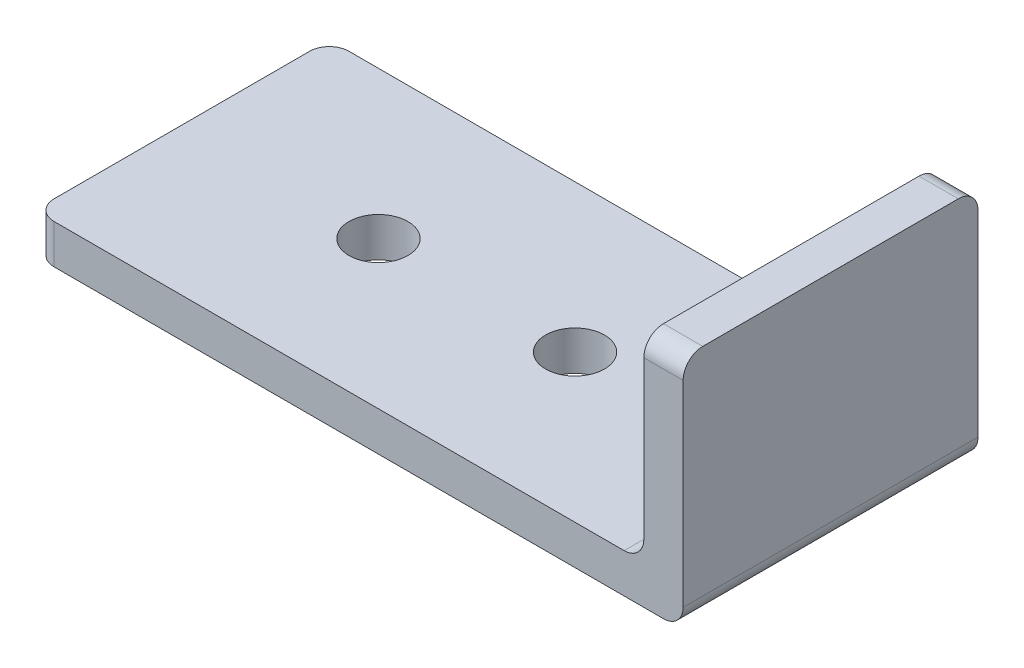
from build123d import *

# Parameters (mm, degrees)
BOSS_EXTRUDE1_DEPTH = 2
SKETCH2_W           = 2
SKETCH2_H           = 15
BOSS_EXTRUDE2_DEPTH = 10
FILLET1_R           = 1
FILLET2_R           = 1


with BuildPart() as part:
    # Sketch1 → Boss-Extrude1 (new body)
    with BuildSketch(Plane(origin=(0, 0, 0), x_dir=(1, 0, 0), z_dir=(0, 1, 0))):
        with BuildLine():
            Line((33, 7.5), (21.5, 7.5))
            ThreePointArc((21.5, 7.5), (20, 6), (18.5, 7.5))
            Line((18.5, 7.5), (11.5, 7.5))
            ThreePointArc((11.5, 7.5), (10, 6), (8.5, 7.5))
            Line((8.5, 7.5), (0, 7.5))
            Line((0, 7.5), (0, 0))
            Line((0, 0), (33, 0))
            Line((33, 0), (33, 7.5))
        make_face()
        with BuildLine():
            ThreePointArc((18.5, 7.5), (20, 9), (21.5, 7.5))
            Line((21.5, 7.5), (33, 7.5))
            Line((33, 7.5), (33, 15))
            Line((33, 15), (0, 15))
            Line((0, 15), (0, 7.5))
            Line((0, 7.5), (8.5, 7.5))
            ThreePointArc((8.5, 7.5), (10, 9), (11.5, 7.5))
            Line((11.5, 7.5), (18.5, 7.5))
        make_face()
    extrude(amount=BOSS_EXTRUDE1_DEPTH)

    # Sketch2 → Boss-Extrude2 (add)
    with BuildSketch(Plane(origin=(0, 2, 0), x_dir=(1, 0, 0), z_dir=(0, 1, 0))):
        with Locations((32, 7.5)):
            Rectangle(SKETCH2_W, SKETCH2_H)
    extrude(amount=BOSS_EXTRUDE2_DEPTH)

    # Fillet1
    fillet1_edges = [part.edges().sort_by_distance(p)[0] for p in [
        (0, 1, 0),
        (0, 1, -15),
        (31, 2, -7.5),
        (32, 12, -15),
        (32, 12, 0),
    ]]
    fillet(fillet1_edges, radius=FILLET1_R)

    # Fillet2
    fillet2_edges = [part.edges().sort_by_distance(p)[0] for p in [
        (33, 0, -7.5),
    ]]
    fillet(fillet2_edges, radius=FILLET2_R)


solid = part.part
